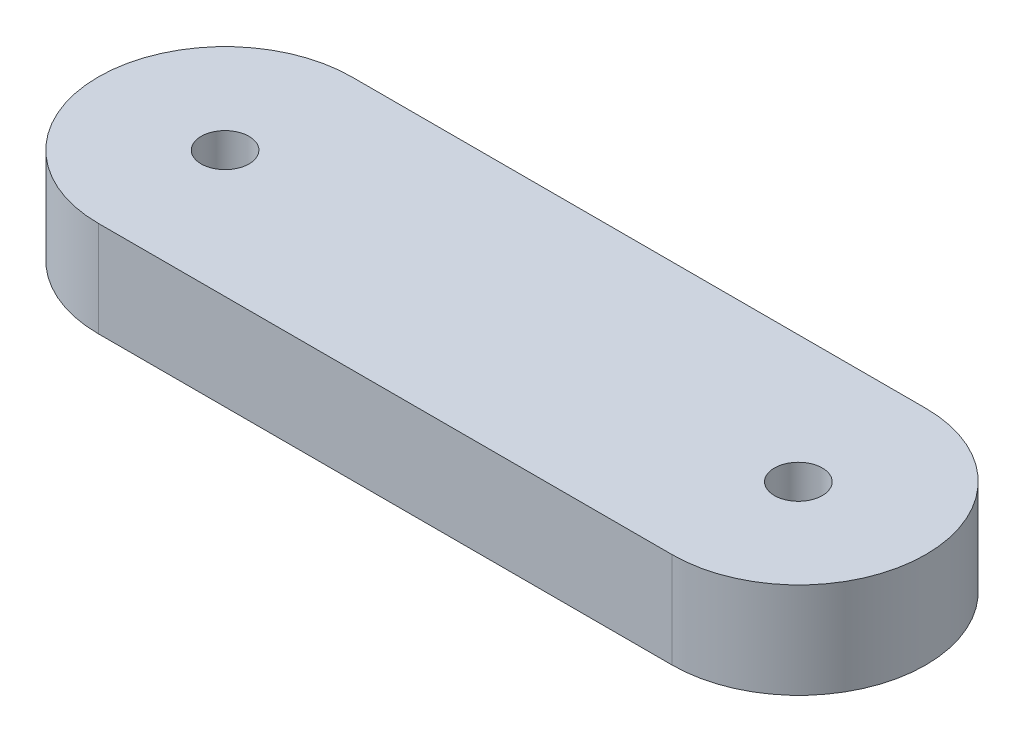
from build123d import *

# Parameters (mm, degrees)
SKETCH_1_R      = 1.501856065
EXTRUDE_1_DEPTH = 6


with BuildPart() as part:
    # Эскиз1 → Бобышка-Вытянуть1 (new body)
    with BuildSketch(Plane(origin=(0, 0, 0), x_dir=(1, 0, 0), z_dir=(0, 1, 0))):
        with BuildLine():
            Line((-16.408851954, 1.855177164), (19.591148045, 1.854908508))
            ThreePointArc((19.591148045, 1.854908508), (27.54533426, -6.099277706), (19.591148045, -14.053463921))
            Line((19.591148045, -14.053463921), (-16.408851954, -14.053463921))
            ThreePointArc((-16.408851954, -14.053463921), (-24.363172497, -6.099143379), (-16.408851954, 1.855177164))
        make_face()
        with Locations(Location((19.591129693, -6.135494448, 0), (0, 0, 270))):
            Circle(SKETCH_1_R, mode=Mode.SUBTRACT)
        with Locations(Location((-16.408851954, -6.099143379, 0), (0, 0, 270))):
            Circle(SKETCH_1_R, mode=Mode.SUBTRACT)
    extrude(amount=EXTRUDE_1_DEPTH)


solid = part.part
